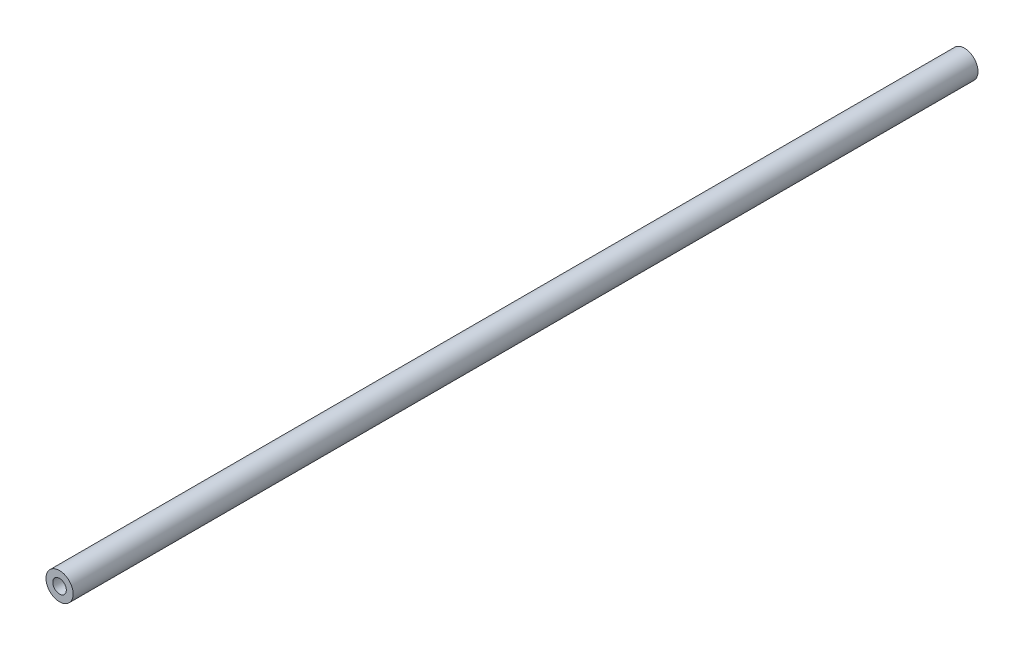
from build123d import *

# Parameters (mm, degrees)
SKETCH1_R           = 3
BOSS_EXTRUDE1_DEPTH = 100
SKETCH2_R           = 1.5
CUT_EXTRUDE1_DEPTH  = 10


with BuildPart() as part:
    # Sketch1 → Boss-Extrude1 (new, symmetric)
    with BuildSketch(Plane.XY):
        Circle(SKETCH1_R)
    extrude(amount=BOSS_EXTRUDE1_DEPTH, both=True)

    # Sketch2 → Cut-Extrude1 (cut)
    with BuildSketch(Plane.XY.offset(100)):
        Circle(SKETCH2_R)
    cut_extrude1 = extrude(amount=-CUT_EXTRUDE1_DEPTH, mode=Mode.SUBTRACT)

    # Mirror1: Cut-Extrude1 across plane
    add(cut_extrude1.mirror(Plane.XY), mode=Mode.SUBTRACT)


solid = part.part
